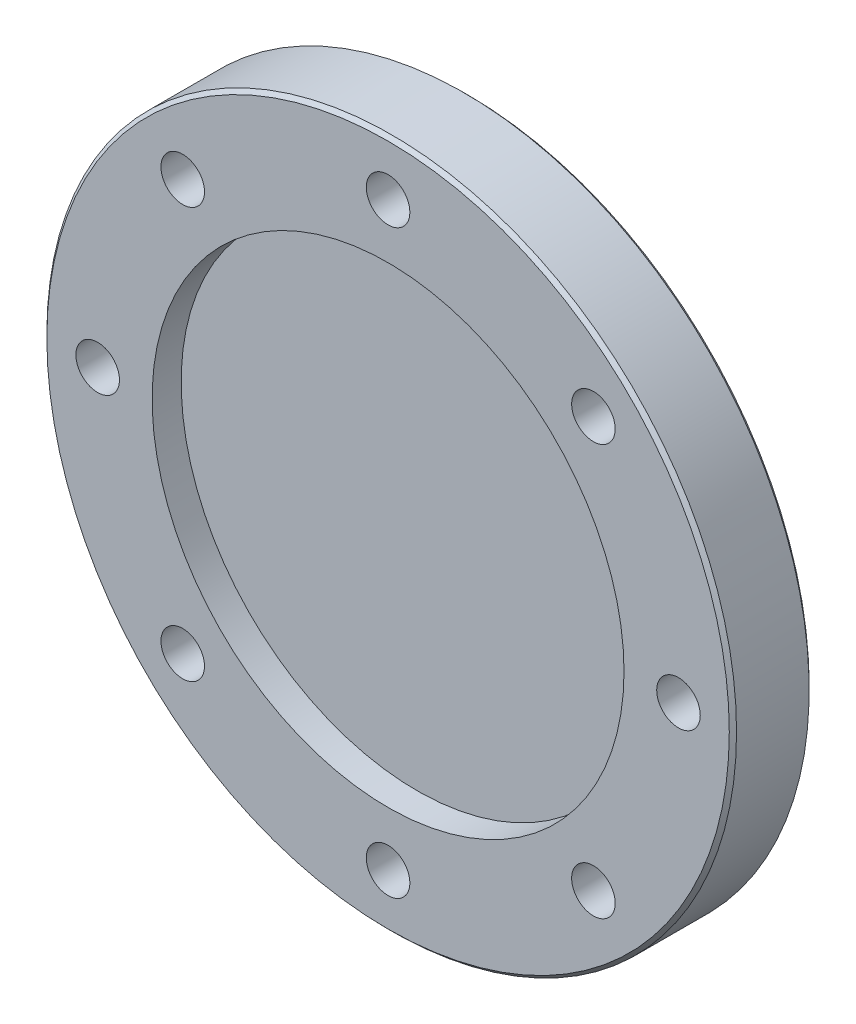
from build123d import *

# Parameters (mm, degrees)
SKETCH_3_R          = 32.5
CUT_EXTRUDE_1_DEPTH = 4
MM_1_D              = 8
MM_1_DEPTH          = 15
MM_1_TIP            = 2.403442476
CUT_EXTRUDE_2_REACH = 72.089
SKETCH_6_R          = 3
CHAMFER_1_SIZE      = 0.5


with BuildPart() as part:
    # 草图1 → 旋转1 (revolve)
    with BuildSketch(Plane(origin=(0, 0, 0), x_dir=(0, 0, -1), z_dir=(1, 0, 0)), mode=Mode.PRIVATE) as revolve_1_sk:
        Polygon((0, 0), (0, 47.5), (11, 47.5), (11, 19), (12, 19), (12, 15), (31, 15), (31, 0), align=None)
    revolve(revolve_1_sk.sketch.rotate(Axis((0, 0, 0), (0, 0, 1)), 90), axis=Axis((0, 0, 0), (0, 0, 1)))

    # 草图3 → 切除-拉伸1 (cut)
    with BuildSketch(Plane.XY):
        Circle(SKETCH_3_R)
    extrude(amount=-CUT_EXTRUDE_1_DEPTH, mode=Mode.SUBTRACT)

    # 大小mm 暗销孔1
    with Locations(Plane(origin=(0, 0, -31), x_dir=(-1, 0, 0), z_dir=(0, 0, -1))):
        with Locations((0, 0)):
            Hole(MM_1_D / 2, depth=MM_1_DEPTH)
            with Locations((0, 0, -(MM_1_DEPTH + MM_1_TIP / 2))):  # 118° drill point
                Cone(0, MM_1_D / 2, MM_1_TIP, mode=Mode.SUBTRACT)

    # 草图6 → 切除-拉伸2 (cut, up to next)
    with BuildSketch(Plane(origin=(0, 0, -11), x_dir=(-1, 0, 0), z_dir=(0, 0, -1)), mode=Mode.PRIVATE) as cut_extrude_2_sk1:
        with Locations((0, 40)):
            Circle(SKETCH_6_R)
    cut_extrude_2_tool1 = extrude(cut_extrude_2_sk1.sketch, amount=-CUT_EXTRUDE_2_REACH, mode=Mode.PRIVATE) & part.part
    # 草图6 → 切除-拉伸2 (cut, up to next)
    with BuildSketch(Plane(origin=(0, 0, -11), x_dir=(-1, 0, 0), z_dir=(0, 0, -1)), mode=Mode.PRIVATE) as cut_extrude_2_sk2:
        with Locations((28.284271247, 28.284271247)):
            Circle(SKETCH_6_R)
    cut_extrude_2_tool2 = extrude(cut_extrude_2_sk2.sketch, amount=-CUT_EXTRUDE_2_REACH, mode=Mode.PRIVATE) & part.part
    # 草图6 → 切除-拉伸2 (cut, up to next)
    with BuildSketch(Plane(origin=(0, 0, -11), x_dir=(-1, 0, 0), z_dir=(0, 0, -1)), mode=Mode.PRIVATE) as cut_extrude_2_sk3:
        with Locations((40, 0)):
            Circle(SKETCH_6_R)
    cut_extrude_2_tool3 = extrude(cut_extrude_2_sk3.sketch, amount=-CUT_EXTRUDE_2_REACH, mode=Mode.PRIVATE) & part.part
    # 草图6 → 切除-拉伸2 (cut, up to next)
    with BuildSketch(Plane(origin=(0, 0, -11), x_dir=(-1, 0, 0), z_dir=(0, 0, -1)), mode=Mode.PRIVATE) as cut_extrude_2_sk4:
        with Locations((28.284271247, -28.284271247)):
            Circle(SKETCH_6_R)
    cut_extrude_2_tool4 = extrude(cut_extrude_2_sk4.sketch, amount=-CUT_EXTRUDE_2_REACH, mode=Mode.PRIVATE) & part.part
    # 草图6 → 切除-拉伸2 (cut, up to next)
    with BuildSketch(Plane(origin=(0, 0, -11), x_dir=(-1, 0, 0), z_dir=(0, 0, -1)), mode=Mode.PRIVATE) as cut_extrude_2_sk5:
        with Locations((0, -40)):
            Circle(SKETCH_6_R)
    cut_extrude_2_tool5 = extrude(cut_extrude_2_sk5.sketch, amount=-CUT_EXTRUDE_2_REACH, mode=Mode.PRIVATE) & part.part
    # 草图6 → 切除-拉伸2 (cut, up to next)
    with BuildSketch(Plane(origin=(0, 0, -11), x_dir=(-1, 0, 0), z_dir=(0, 0, -1)), mode=Mode.PRIVATE) as cut_extrude_2_sk6:
        with Locations((-28.284271247, -28.284271247)):
            Circle(SKETCH_6_R)
    cut_extrude_2_tool6 = extrude(cut_extrude_2_sk6.sketch, amount=-CUT_EXTRUDE_2_REACH, mode=Mode.PRIVATE) & part.part
    # 草图6 → 切除-拉伸2 (cut, up to next)
    with BuildSketch(Plane(origin=(0, 0, -11), x_dir=(-1, 0, 0), z_dir=(0, 0, -1)), mode=Mode.PRIVATE) as cut_extrude_2_sk7:
        with Locations((-40, 0)):
            Circle(SKETCH_6_R)
    cut_extrude_2_tool7 = extrude(cut_extrude_2_sk7.sketch, amount=-CUT_EXTRUDE_2_REACH, mode=Mode.PRIVATE) & part.part
    # 草图6 → 切除-拉伸2 (cut, up to next)
    with BuildSketch(Plane(origin=(0, 0, -11), x_dir=(-1, 0, 0), z_dir=(0, 0, -1)), mode=Mode.PRIVATE) as cut_extrude_2_sk8:
        with Locations((-28.284271247, 28.284271247)):
            Circle(SKETCH_6_R)
    cut_extrude_2_tool8 = extrude(cut_extrude_2_sk8.sketch, amount=-CUT_EXTRUDE_2_REACH, mode=Mode.PRIVATE) & part.part
    add(cut_extrude_2_tool1.solids().sort_by_distance((0, 40, -11))[0], mode=Mode.SUBTRACT)
    add(cut_extrude_2_tool2.solids().sort_by_distance((-28.284271, 28.284271, -11))[0], mode=Mode.SUBTRACT)
    add(cut_extrude_2_tool3.solids().sort_by_distance((-40, 0, -11))[0], mode=Mode.SUBTRACT)
    add(cut_extrude_2_tool4.solids().sort_by_distance((-28.284271, -28.284271, -11))[0], mode=Mode.SUBTRACT)
    add(cut_extrude_2_tool5.solids().sort_by_distance((0, -40, -11))[0], mode=Mode.SUBTRACT)
    add(cut_extrude_2_tool6.solids().sort_by_distance((28.284271, -28.284271, -11))[0], mode=Mode.SUBTRACT)
    add(cut_extrude_2_tool7.solids().sort_by_distance((40, 0, -11))[0], mode=Mode.SUBTRACT)
    add(cut_extrude_2_tool8.solids().sort_by_distance((28.284271, 28.284271, -11))[0], mode=Mode.SUBTRACT)

    # 倒角1
    chamfer_1_edges = [part.edges().sort_by_distance(p)[0] for p in [
        (-4, 0, -31),
        (15, 0, -31),
        (47.5, 0, -11),
        (47.5, 0, 0),
    ]]
    chamfer(chamfer_1_edges, length=CHAMFER_1_SIZE)


solid = part.part
